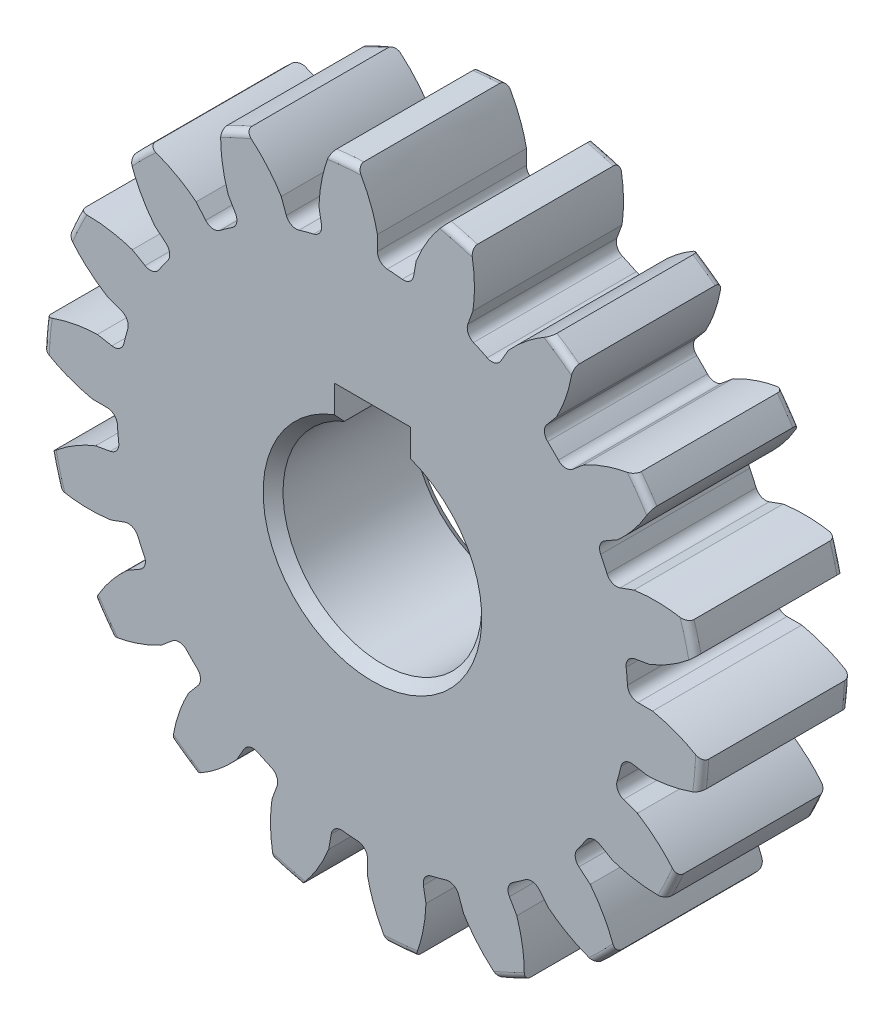
from build123d import *

# Parameters (mm, degrees)
SKETCH1_R                = 10.541
BOSS_EXTRUDE1_DEPTH      = 4.7625
SKETCH2_W                = 6.3373
SKETCH2_H                = 6.35
FILLET2_R                = 0.21082
CUT_EXTRUDE1_DEPTH       = 19.585772146
FILLET1_R                = 0.332486
CIRPATTERN1_COUNT        = 18
FILLET1_OF_CIRPATTERN1_R = 0.332486
SKETCH5_R                = 3.175
CUT_EXTRUDE2_DEPTH       = 19.572998108
SKETCH6_R                = 9.525
CUT_EXTRUDE3_DEPTH       = 17.183697661
CHAMFER1_SIZE            = 0.3175
CUT_EXTRUDE4_DEPTH       = 16.634324606
CUT_EXTRUDE4_DEPTH_BACK  = 16.634324606
SKETCH7_W                = 2.43205
SKETCH7_H                = 2.43205


with BuildPart() as part:
    # Sketch1 → Boss-Extrude1 (new body)
    with BuildSketch(Plane.XY):
        Circle(SKETCH1_R)
    extrude(amount=-BOSS_EXTRUDE1_DEPTH)

    # Sketch2 → Revolve1 (revolve)
    with BuildSketch(Plane(origin=(0, 0, 0), x_dir=(0, 0, -1), z_dir=(1, 0, 0)), mode=Mode.PRIVATE) as revolve1_sk:
        with Locations((7.93115, 3.175)):
            Rectangle(SKETCH2_W, SKETCH2_H)
    revolve(revolve1_sk.sketch.rotate(Axis((0, 0, -4.7625), (0, 0, -1)), 90), axis=Axis((0, 0, -4.7625), (0, 0, -1)))

    # Fillet2
    fillet2_edges = [part.edges().sort_by_distance(p)[0] for p in [
        (-10.541, 0, 0),
        (-10.541, 0, -4.7625),
        (-6.35, 0, -4.7625),
    ]]
    fillet(fillet2_edges, radius=FILLET2_R)

    # Sketch4 → Cut-Extrude1 (cut, through all)
    with BuildSketch(Plane.XY):
        with BuildLine():
            Line((0.157561629, 8.949185285), (0.157561629, 8.158228631))
            ThreePointArc((0.157561629, 8.158228631), (0.711170731, 8.128699543), (1.261496911, 8.061646582))
            Line((1.261496911, 8.061646582), (1.398845411, 8.840586771))
            add(Edge.make_bspline(
                [(4.497758077, 11.696351513), (2.192075376, 10.823747212), (1.398845411, 8.840586771)],
                knots=[0, 0, 0, 1, 1, 1], degree=2))
            ThreePointArc((4.497758077, 11.696351513), (1.092180738, 12.483653619), (-2.39837188, 12.299686125))
            add(Edge.make_bspline(
                [(-2.39837188, 12.299686125), (-0.279244341, 11.039960179), (0.157561629, 8.949185285)],
                knots=[0, 0, 0, 1, 1, 1], degree=2))
        make_face()
    cut_extrude1 = extrude(amount=-CUT_EXTRUDE1_DEPTH, mode=Mode.SUBTRACT)

    # Fillet1
    fillet1_edges = [part.edges().sort_by_distance(p)[0] for p in [
        (1.261496911, 8.061646582, -2.38125),
        (0.157561629, 8.158228631, -2.38125),
    ]]
    fillet(fillet1_edges, radius=FILLET1_R)

    # CirPattern1: Cut-Extrude1 ×18 about axis
    cirpattern1_axis = Axis((0, 0, -4.7625), (0, 0, 1))
    for i in range(1, CIRPATTERN1_COUNT):
        add(cut_extrude1.rotate(cirpattern1_axis, i * 360 / CIRPATTERN1_COUNT), mode=Mode.SUBTRACT)

    # Fillet1 of CirPattern1
    fillet1_of_cirpattern1_edges = [part.edges().sort_by_distance(p)[0] for p in [
        (-1.57182618, 8.006927158, -2.38125),
        (-2.642219026, 7.720116494, -2.38125),
        (-4.215563837, 6.98645415, -2.38125),
        (-5.123309071, 6.350844371, -2.38125),
        (-6.35084228, 5.123311663, -2.38125),
        (-6.98645243, 4.215566689, -2.38125),
        (-7.720115416, 2.642222177, -2.38125),
        (-8.006926517, 1.571829448, -2.38125),
        (-8.158228695, -0.157558299, -2.38125),
        (-8.061647096, -1.261493621, -2.38125),
        (-7.612339192, -2.938334919, -2.38125),
        (-7.144014059, -3.942661942, -2.38125),
        (-6.148289235, -5.364704982, -2.38125),
        (-5.364707491, -6.148287046, -2.38125),
        (-3.942664858, -7.14401245, -2.38125),
        (-2.938338026, -7.612337992, -2.38125),
        (-1.261496911, -8.061646582, -2.38125),
        (-0.157561629, -8.158228631, -2.38125),
        (1.57182618, -8.006927158, -2.38125),
        (2.642219026, -7.720116494, -2.38125),
        (4.215563837, -6.98645415, -2.38125),
        (5.123309071, -6.350844371, -2.38125),
        (6.35084228, -5.123311663, -2.38125),
        (6.98645243, -4.215566689, -2.38125),
        (7.720115416, -2.642222177, -2.38125),
        (8.006926517, -1.571829448, -2.38125),
        (8.158228695, 0.157558299, -2.38125),
        (8.061647096, 1.261493621, -2.38125),
        (7.612339192, 2.938334919, -2.38125),
        (7.144014059, 3.942661942, -2.38125),
        (6.148289235, 5.364704982, -2.38125),
        (5.364707491, 6.148287046, -2.38125),
        (3.942664858, 7.14401245, -2.38125),
        (2.938338026, 7.612337992, -2.38125),
    ]]
    fillet(fillet1_of_cirpattern1_edges, radius=FILLET1_OF_CIRPATTERN1_R)

    # Sketch5 → Cut-Extrude2 (cut, through all)
    with BuildSketch(Plane.XY):
        Circle(SKETCH5_R)
    extrude(amount=-CUT_EXTRUDE2_DEPTH, mode=Mode.SUBTRACT)

    # Sketch6 → Cut-Extrude3 (cut, through all)
    with BuildSketch(Plane(origin=(0, 0, -4.7625), x_dir=(-1, 0, 0), z_dir=(0, 0, -1))):
        Circle(SKETCH6_R)
    extrude(amount=CUT_EXTRUDE3_DEPTH, mode=Mode.SUBTRACT)

    # Chamfer1
    chamfer1_edges = [part.edges().sort_by_distance(p)[0] for p in [
        (-3.175, 0, 0),
        (-3.175, 0, -4.7625),
    ]]
    chamfer(chamfer1_edges, length=CHAMFER1_SIZE)

    # Sketch7 → Cut-Extrude4 (cut, two sides: drawn at the far end of the back side and taken through both)
    with BuildSketch(Plane(origin=(0, 0, -4.7625), x_dir=(-1, 0, 0), z_dir=(0, 0, -1)).offset(-CUT_EXTRUDE4_DEPTH_BACK)):
        with Locations((0, 2.932900987)):
            Rectangle(SKETCH7_W, SKETCH7_H)
    extrude(amount=CUT_EXTRUDE4_DEPTH + CUT_EXTRUDE4_DEPTH_BACK, mode=Mode.SUBTRACT)


solid = part.part
